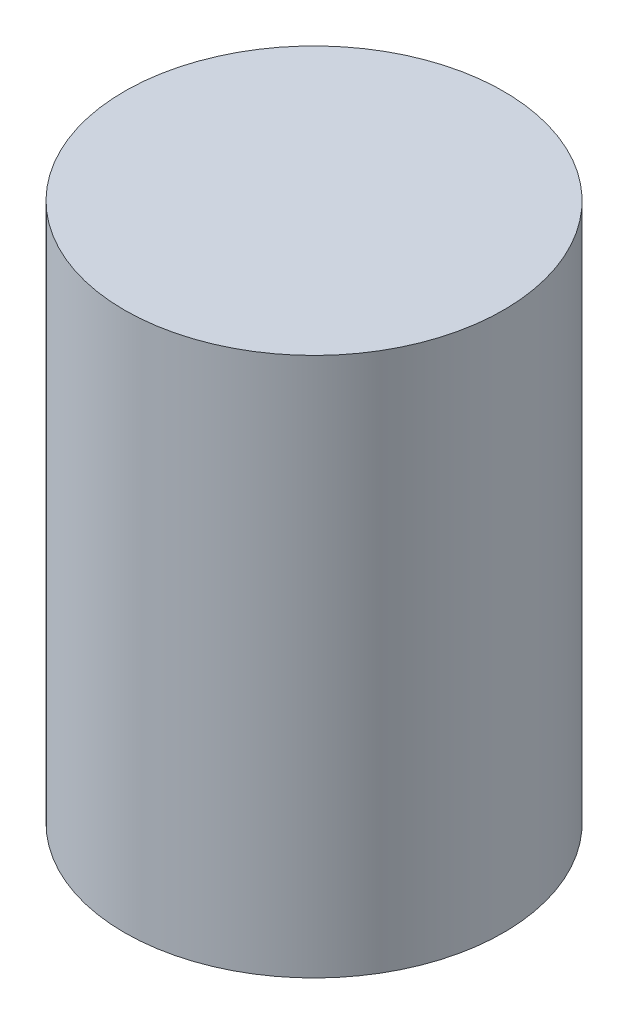
from build123d import *

# Parameters (mm, degrees)
SKETCH1_R           = 11.25
BOSS_EXTRUDE1_DEPTH = 32


with BuildPart() as part:
    # Sketch1 → Boss-Extrude1 (new body)
    with BuildSketch(Plane(origin=(0, 0, 0), x_dir=(1, 0, 0), z_dir=(0, 1, 0))):
        with Locations(Location((0, 0, 0), (0, 0, 270))):
            Circle(SKETCH1_R)
    extrude(amount=BOSS_EXTRUDE1_DEPTH)


solid = part.part
